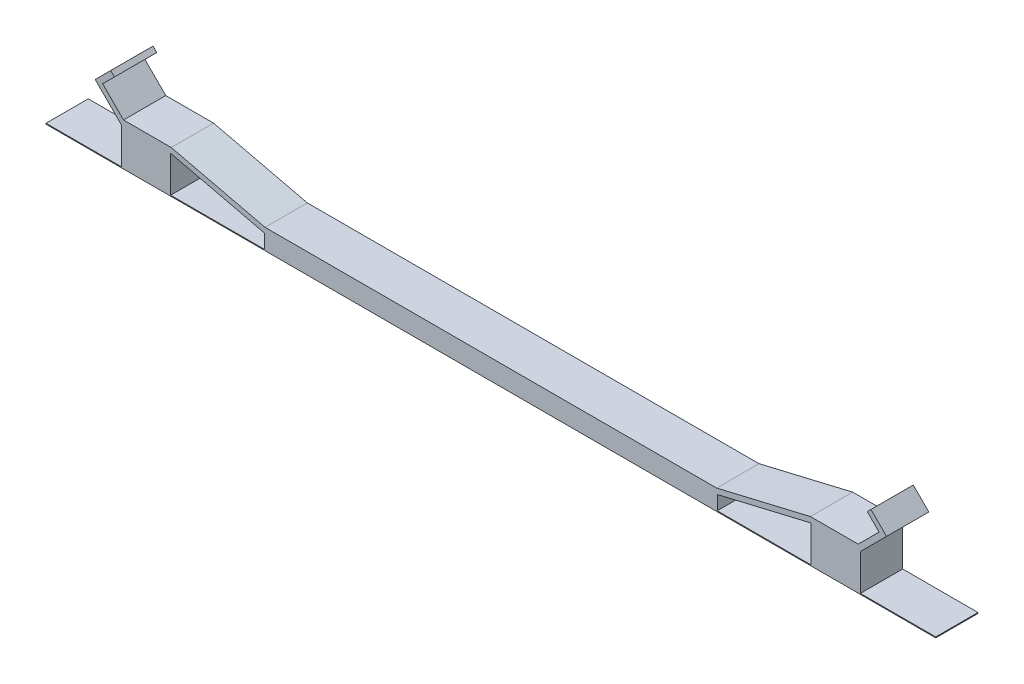
from build123d import *

# Parameters (mm, degrees)
SKETCH2_W           = 1010
SKETCH2_H           = 48
BOSS_EXTRUDE1_DEPTH = 1
SKETCH3_W           = 514
SKETCH3_H           = 48
BOSS_EXTRUDE2_DEPTH = 16
SKETCH4_W           = 56
SKETCH4_H           = 48
BOSS_EXTRUDE3_DEPTH = 41.2
EXTRUDE_THIN1_DEPTH = 48


with BuildPart() as part:
    # Sketch2 → Boss-Extrude1 (new body)
    with BuildSketch(Plane(origin=(0, 0, 0), x_dir=(1, 0, 0), z_dir=(0, 1, 0))):
        Rectangle(SKETCH2_W, SKETCH2_H)
    extrude(amount=BOSS_EXTRUDE1_DEPTH)

    # Sketch3 → Boss-Extrude2 (add)
    with BuildSketch(Plane(origin=(0, 1, 0), x_dir=(1, 0, 0), z_dir=(0, 1, 0))):
        Rectangle(SKETCH3_W, SKETCH3_H)
    extrude(amount=BOSS_EXTRUDE2_DEPTH)

    # Sketch4 → Boss-Extrude3 (add)
    with BuildSketch(Plane(origin=(0, 1, 0), x_dir=(1, 0, 0), z_dir=(0, 1, 0))):
        with Locations((-391.494906848, 0)):
            Rectangle(SKETCH4_W, SKETCH4_H)
    boss_extrude3 = extrude(amount=BOSS_EXTRUDE3_DEPTH)

    # Mirror1: Boss-Extrude3 across plane
    add(boss_extrude3.mirror(Plane(origin=(0, 0, 0), x_dir=(0, 0, 1), z_dir=(1, 0, 0))))

    # Sketch7 → Extrude-Thin1 (add)
    with BuildSketch(Plane.XY.offset(24)):
        Polygon((-431.515722128, 89.576154339), (-449.193391658, 71.89848481), (-419.494906848, 42.2), (-363.494906848, 42.2), (-257, 17), (257, 17), (363.494906848, 42.2), (419.494906848, 42.2), (449.193391658, 71.89848481), (431.515722128, 89.576154339), (427.273081441, 85.333513652), (440.708110284, 71.89848481), (417.009625474, 48.2), (362.794682376, 48.2), (256.299775528, 23), (-256.299775528, 23), (-362.794682376, 48.2), (-417.009625474, 48.2), (-440.708110284, 71.89848481), (-427.273081441, 85.333513652), align=None)
    extrude(amount=-EXTRUDE_THIN1_DEPTH)


solid = part.part
